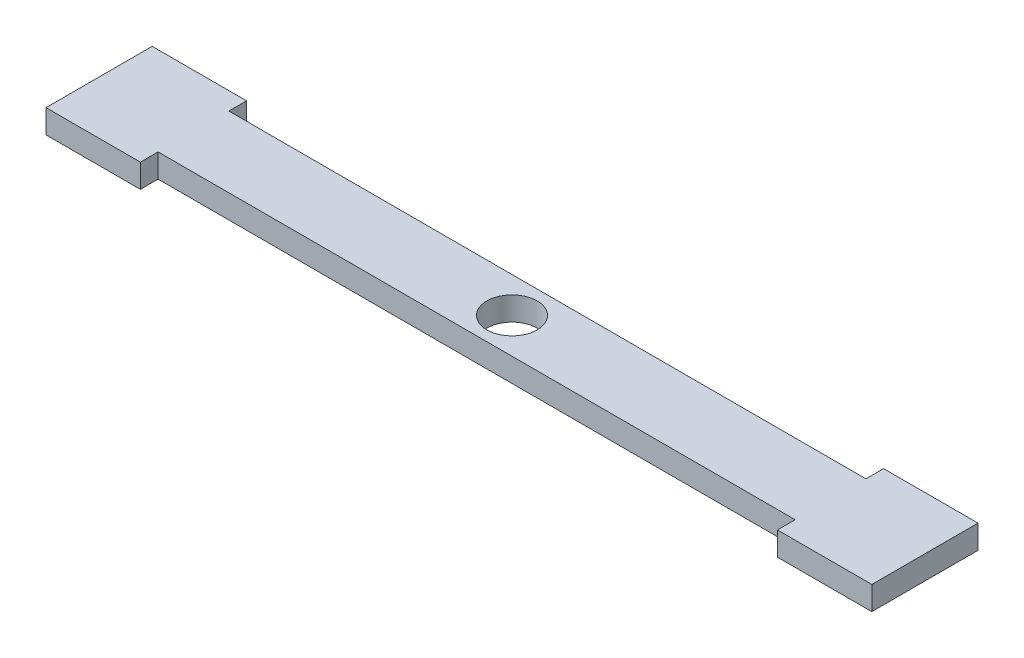
from build123d import *

# Parameters (mm, degrees)
SKETCH1_R           = 10.65
BOSS_EXTRUDE1_DEPTH = 10


with BuildPart() as part:
    # Sketch1 → Boss-Extrude1 (new body)
    with BuildSketch(Plane(origin=(0, 0, 0), x_dir=(1, 0, 0), z_dir=(0, 1, 0))):
        Polygon((-33.290676075, 17.5), (236.709323925, 17.5), (236.709323925, 25), (276.709323925, 25), (276.709323925, -20), (236.709323925, -20), (236.709323925, -12.5), (-33.290676075, -12.5), (-33.290676075, -20), (-73.290676075, -20), (-73.290676075, 25), (-33.290676075, 25), align=None)
        with Locations(Location((101.709323925, 2.5, 0), (0, 0, 270))):
            Circle(SKETCH1_R, mode=Mode.SUBTRACT)
    extrude(amount=BOSS_EXTRUDE1_DEPTH)


solid = part.part
